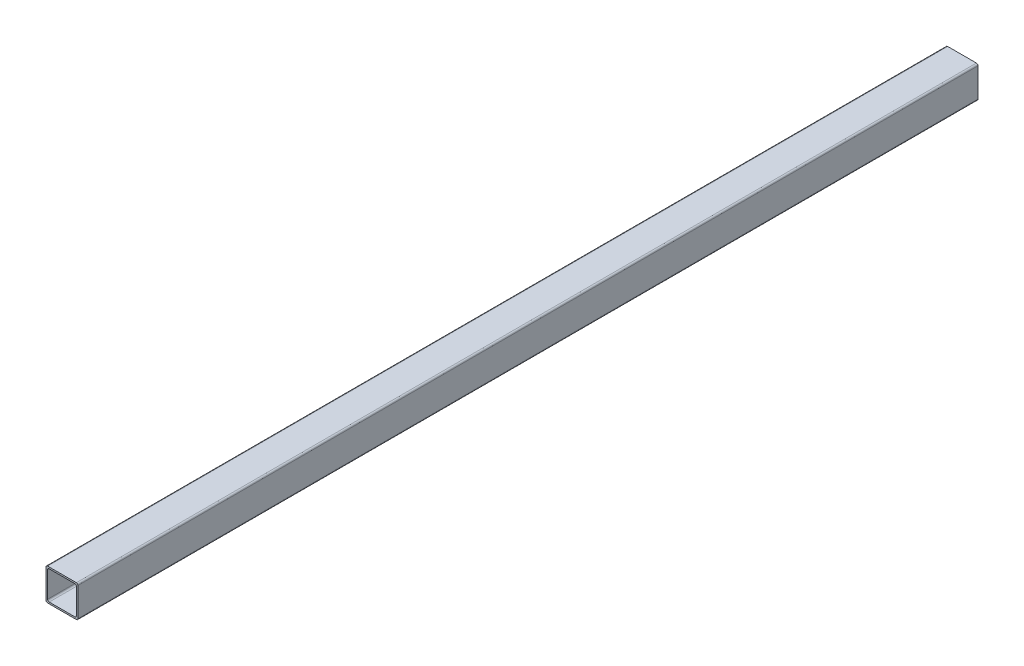
from build123d import *

# Parameters (mm, degrees)
DODANIE_WYCI_GNI_CIE1_DEPTH = 1690


with BuildPart() as part:
    # Szkic1 → Dodanie-wyciągnięcie1 (new body)
    with BuildSketch(Plane.XY):
        with BuildLine():
            ThreePointArc((0, 57), (0.878679656, 59.121320344), (3, 60))
            Line((3, 60), (57, 60))
            ThreePointArc((57, 60), (59.121320344, 59.121320344), (60, 57))
            Line((60, 57), (60, 3))
            ThreePointArc((60, 3), (59.121320344, 0.878679656), (57, 0))
            Line((57, 0), (3, 0))
            ThreePointArc((3, 0), (0.878679656, 0.878679656), (0, 3))
            Line((0, 3), (0, 57))
        make_face()
        with BuildLine():
            Line((3, 6), (3, 54))
            ThreePointArc((3, 54), (3.878679656, 56.121320344), (6, 57))
            Line((6, 57), (54, 57))
            ThreePointArc((54, 57), (56.121320344, 56.121320344), (57, 54))
            Line((57, 54), (57, 6))
            ThreePointArc((57, 6), (56.121320344, 3.878679656), (54, 3))
            Line((54, 3), (6, 3))
            ThreePointArc((6, 3), (3.878679656, 3.878679656), (3, 6))
        make_face(mode=Mode.SUBTRACT)
    extrude(amount=DODANIE_WYCI_GNI_CIE1_DEPTH)


solid = part.part
